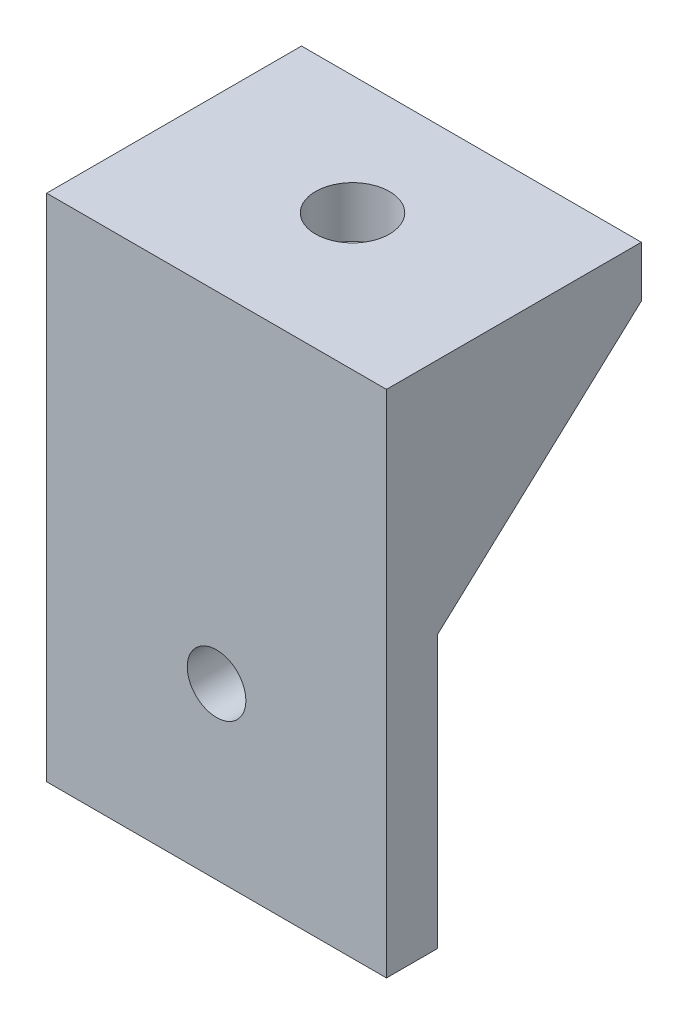
from build123d import *

# Parameters (mm, degrees)
SKETCH1_W           = 20
SKETCH1_H           = 30
BOSS_EXTRUDE1_DEPTH = 3
SKETCH2_W           = 20
SKETCH2_H           = 3
BOSS_EXTRUDE2_DEPTH = 12
SKETCH3_R           = 2.175
CUT_EXTRUDE1_DEPTH  = 12
SKETCH5_R           = 1.725
CUT_EXTRUDE2_DEPTH  = 12
BOSS_EXTRUDE3_DEPTH = 2


with BuildPart() as part:
    # Sketch1 → Boss-Extrude1 (new body)
    with BuildSketch(Plane.XY):
        with Locations((5.222929936, 11.719745223)):
            Rectangle(SKETCH1_W, SKETCH1_H)
    extrude(amount=BOSS_EXTRUDE1_DEPTH)

    # Sketch2 → Boss-Extrude2 (add)
    with BuildSketch(Plane(origin=(0, 0, 0), x_dir=(-1, 0, 0), z_dir=(0, 0, -1))):
        with Locations((-5.222929936, 25.219745223)):
            Rectangle(SKETCH2_W, SKETCH2_H)
    extrude(amount=BOSS_EXTRUDE2_DEPTH)

    # Sketch3 → Cut-Extrude1 (cut)
    with BuildSketch(Plane(origin=(0, 26.719745223, 0), x_dir=(1, 0, 0), z_dir=(0, 1, 0))):
        with Locations(Location((5.222929936, 5, 0), (0, 0, 270))):
            Circle(SKETCH3_R)
    extrude(amount=-CUT_EXTRUDE1_DEPTH, mode=Mode.SUBTRACT)

    # Sketch5 → Cut-Extrude2 (cut)
    with BuildSketch(Plane(origin=(0, 0, 0), x_dir=(-1, 0, 0), z_dir=(0, 0, -1))):
        with Locations((-5.222929936, 6.719745223)):
            Circle(SKETCH5_R)
    extrude(amount=-CUT_EXTRUDE2_DEPTH, mode=Mode.SUBTRACT)

    # Sketch6 → Boss-Extrude3 (add)
    with BuildSketch(Plane.ZY.offset(4.777070064)):
        Polygon((-12, 23.719745223), (0, 23.719745223), (0, 12.719745223), align=None)
    boss_extrude3 = extrude(amount=-BOSS_EXTRUDE3_DEPTH)

    # Mirror1: Boss-Extrude3 across plane
    add(boss_extrude3.mirror(Plane.ZY.offset(-5.222929936)))


solid = part.part
